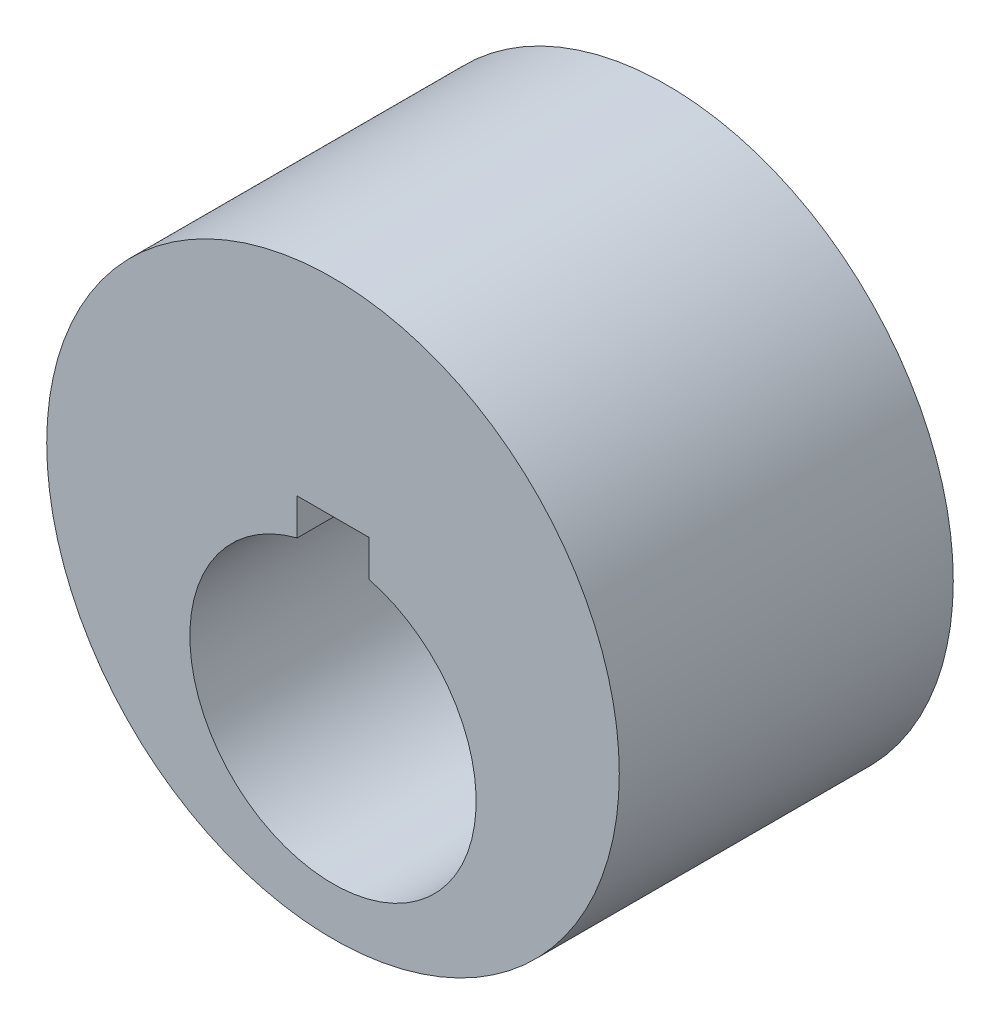
from build123d import *

# Parameters (mm, degrees)
ESQUISSE1_W                        = 36
ESQUISSE1_H                        = 42
ENL_V_MAT_EXTRU_1_REACH            = 75.239
ESQUISSE3_W                        = 18
ESQUISSE3_H                        = 42
DIAM_TRE_DU_PER_AGE_M6_0_6_1_D     = 6
DIAM_TRE_DU_PER_AGE_M6_0_6_1_DEPTH = 14
DIAM_TRE_DU_PER_AGE_M6_0_6_1_TIP   = 1.732050808


with BuildPart() as part:
    # Esquisse1 → Révolution1 (revolve)
    with BuildSketch(Plane.XZ.offset(-12), mode=Mode.PRIVATE) as r_volution1_sk:
        with Locations((18, 21)):
            Rectangle(ESQUISSE1_W, ESQUISSE1_H)
    revolve(r_volution1_sk.sketch.rotate(Axis((0, 12, 42), (0, 0, -1)), 180), axis=Axis((0, 12, 42), (0, 0, -1)))

    # Esquisse2 → Enlèv. mat.-Extru.1 (cut, up to next)
    with BuildSketch(Plane(origin=(0, 0, 0), x_dir=(-1, 0, 0), z_dir=(0, 0, -1)), mode=Mode.PRIVATE) as enl_v_mat_extru_1_sk1:
        with BuildLine():
            Line((4.5, 22), (-4.5, 22))
            Line((-4.5, 22), (-4.5, 17.428425058))
            ThreePointArc((-4.5, 17.428425058), (0, 18), (4.5, 17.428425058))
            Line((4.5, 17.428425058), (4.5, 22))
        make_face()
    enl_v_mat_extru_1_tool1 = extrude(enl_v_mat_extru_1_sk1.sketch, amount=-ENL_V_MAT_EXTRU_1_REACH, mode=Mode.PRIVATE) & part.part
    add(enl_v_mat_extru_1_tool1.solids().sort_by_distance((0, 19.901901, 0))[0], mode=Mode.SUBTRACT)

    # Esquisse3 → Enlèvement de matière-Révolution1 (revolve, cut)
    with BuildSketch(Plane(origin=(0, 0, 0), x_dir=(1, 0, 0), z_dir=(0, 1, 0))):
        with Locations((9, -21)):
            Rectangle(ESQUISSE3_W, ESQUISSE3_H)
    revolve(axis=Axis((0, 0, 0), (0, 0, 1)), mode=Mode.SUBTRACT)

    # Diamètre du perçage M6.0 (6)1
    with Locations(Plane(origin=(0, 0, 0), x_dir=(-1, 0, 0), z_dir=(0, 0, -1))):
        with Locations((0, 42)):
            Hole(DIAM_TRE_DU_PER_AGE_M6_0_6_1_D / 2, depth=DIAM_TRE_DU_PER_AGE_M6_0_6_1_DEPTH)
            with Locations((0, 0, -(DIAM_TRE_DU_PER_AGE_M6_0_6_1_DEPTH + DIAM_TRE_DU_PER_AGE_M6_0_6_1_TIP / 2))):  # 120° drill point
                Cone(0, DIAM_TRE_DU_PER_AGE_M6_0_6_1_D / 2, DIAM_TRE_DU_PER_AGE_M6_0_6_1_TIP, mode=Mode.SUBTRACT)


solid = part.part
